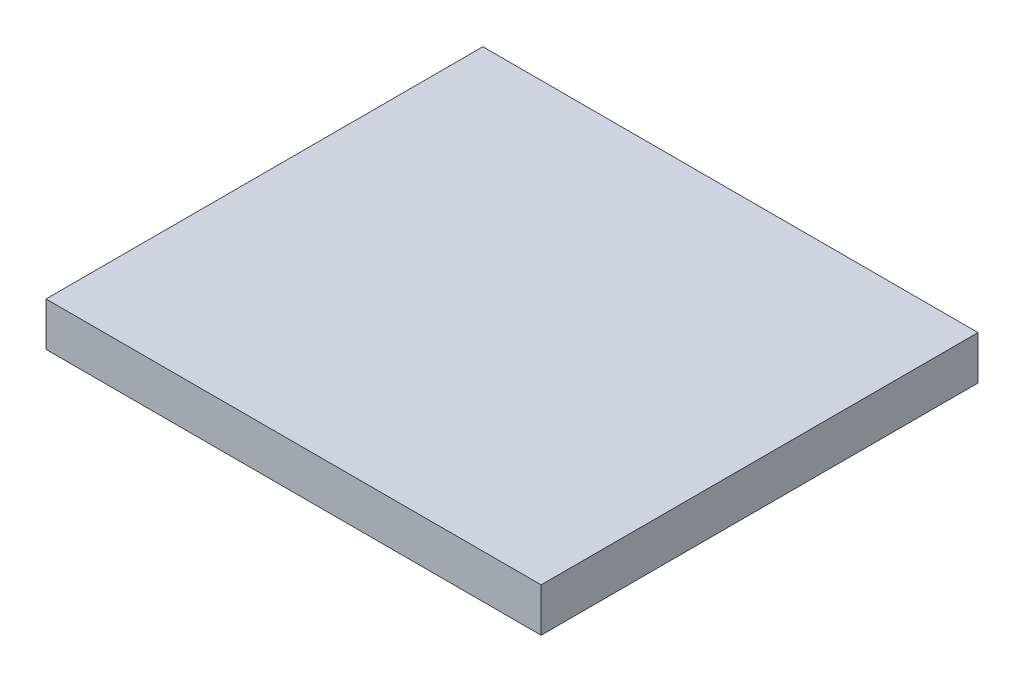
from build123d import *

# Parameters (mm, degrees)
ESBO_O1_W                = 34
ESBO_O1_H                = 3
RESSALTO_EXTRUS_O1_DEPTH = 30


with BuildPart() as part:
    # Esboço1 → Ressalto-extrusão1 (new body)
    with BuildSketch(Plane.XY):
        with Locations((-17, 1.5)):
            Rectangle(ESBO_O1_W, ESBO_O1_H)
    extrude(amount=RESSALTO_EXTRUS_O1_DEPTH)


solid = part.part
